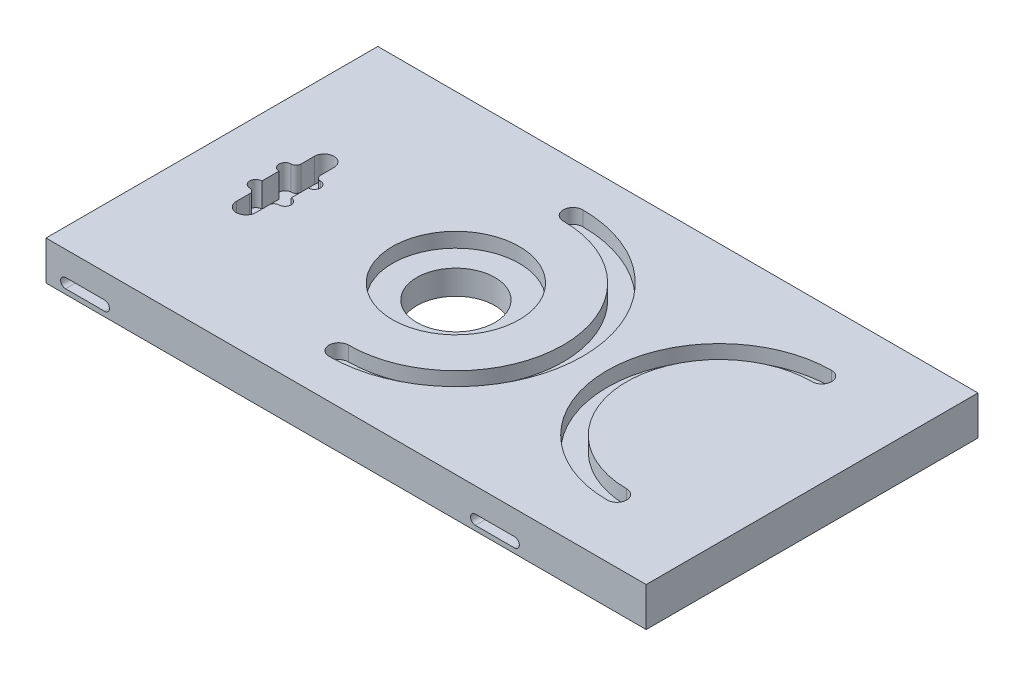
from build123d import *

# Parameters (mm, degrees)
SKETCH1_W              = 123
SKETCH1_H              = 68
BOSS_EXTRUDE1_DEPTH    = 8
CUT_EXTRUDE1_DEPTH     = 5
LPATTERN6_COUNT        = 2
LPATTERN6_PITCH        = 84
LPATTERN6_COPY_1_DEPTH = 5
SKETCH7_R              = 8
CUT_EXTRUDE2_DEPTH     = 10
SKETCH8_R              = 13
CUT_EXTRUDE3_DEPTH     = 3
CUT_EXTRUDE4_DEPTH     = 5
CUT_EXTRUDE5_DEPTH     = 3
CUT_EXTRUDE6_DEPTH     = 3
CUT_EXTRUDE7_DEPTH     = 5
FILLET2_R              = 1


with BuildPart() as part:
    # Sketch1 → Boss-Extrude1 (new body)
    with BuildSketch(Plane(origin=(0, 0, 0), x_dir=(1, 0, 0), z_dir=(0, 1, 0))):
        Rectangle(SKETCH1_W, SKETCH1_H)
    extrude(amount=BOSS_EXTRUDE1_DEPTH)

    # Sketch6 → Cut-Extrude1 (cut)
    with BuildSketch(Plane(origin=(0, 0, -34), x_dir=(-1, 0, 0), z_dir=(0, 0, -1))):
        with BuildLine():
            Line((49.5, 3), (57.5, 3))
            ThreePointArc((57.5, 3), (58.5, 2), (57.5, 1))
            Line((57.5, 1), (49.5, 1))
            ThreePointArc((49.5, 1), (48.5, 2), (49.5, 3))
        make_face()
    cut_extrude1 = extrude(amount=-CUT_EXTRUDE1_DEPTH, mode=Mode.SUBTRACT)

    # Mirror16: Cut-Extrude1 across plane
    add(cut_extrude1.mirror(Plane.XY), mode=Mode.SUBTRACT)

    # LPattern6: Cut-Extrude1 ×2
    with Locations(*[(i * LPATTERN6_PITCH, 0, 0) for i in range(1, LPATTERN6_COUNT)]):
        add(cut_extrude1, mode=Mode.SUBTRACT)

    # LPattern6 copy 1 sketch → LPattern6 copy 1 (cut)
    with BuildSketch(Plane(origin=(84, 0, 34), x_dir=(-1, 0, 0), z_dir=(0, 0, 1))):
        with BuildLine():
            Line((49.5, -3), (57.5, -3))
            ThreePointArc((57.5, -3), (58.5, -2), (57.5, -1))
            Line((57.5, -1), (49.5, -1))
            ThreePointArc((49.5, -1), (48.5, -2), (49.5, -3))
        make_face()
    extrude(amount=-LPATTERN6_COPY_1_DEPTH, mode=Mode.SUBTRACT)

    # Sketch7 → Cut-Extrude2 (cut)
    with BuildSketch(Plane(origin=(0, 8, 0), x_dir=(1, 0, 0), z_dir=(0, 1, 0))):
        with Locations(Location((-11.5, 0, 0), (0, 0, 270))):
            Circle(SKETCH7_R)
    extrude(amount=-CUT_EXTRUDE2_DEPTH, mode=Mode.SUBTRACT)

    # Sketch8 → Cut-Extrude3 (cut)
    with BuildSketch(Plane(origin=(0, 8, 0), x_dir=(1, 0, 0), z_dir=(0, 1, 0))):
        with Locations(Location((-11.5, 0, 0), (0, 0, 270))):
            Circle(SKETCH8_R)
    extrude(amount=-CUT_EXTRUDE3_DEPTH, mode=Mode.SUBTRACT)

    # Sketch9 → Cut-Extrude4 (cut)
    with BuildSketch(Plane(origin=(0, 8, 0), x_dir=(1, 0, 0), z_dir=(0, 1, 0))):
        with BuildLine():
            Line((-44.5, 8), (-44.5, -8))
            ThreePointArc((-44.5, -8), (-46.5, -10), (-48.5, -8))
            Line((-48.5, -8), (-48.5, 8))
            ThreePointArc((-48.5, 8), (-46.5, 10), (-44.5, 8))
        make_face()
    extrude(amount=-CUT_EXTRUDE4_DEPTH, mode=Mode.SUBTRACT)

    # Sketch10 → Cut-Extrude5 (cut)
    with BuildSketch(Plane(origin=(0, 8, 0), x_dir=(1, 0, 0), z_dir=(0, 1, 0))):
        with BuildLine():
            ThreePointArc((42.5, 23), (19.5, 0), (42.5, -23))
            ThreePointArc((42.5, -23), (44.5, -21), (42.5, -19))
            ThreePointArc((42.5, -19), (23.5, 0), (42.5, 19))
            ThreePointArc((42.5, 19), (44.5, 21), (42.5, 23))
        make_face()
    extrude(amount=-CUT_EXTRUDE5_DEPTH, mode=Mode.SUBTRACT)

    # Sketch11 → Cut-Extrude6 (cut)
    with BuildSketch(Plane(origin=(0, 8, 0), x_dir=(1, 0, 0), z_dir=(0, 1, 0))):
        with BuildLine():
            ThreePointArc((-11.5, -26), (14.5, 0), (-11.5, 26))
            ThreePointArc((-11.5, 26), (-13.5, 24), (-11.5, 22))
            ThreePointArc((-11.5, 22), (10.5, 0), (-11.5, -22))
            ThreePointArc((-11.5, -22), (-13.5, -24), (-11.5, -26))
        make_face()
    extrude(amount=-CUT_EXTRUDE6_DEPTH, mode=Mode.SUBTRACT)

    # Sketch12 → Cut-Extrude7 (cut)
    with BuildSketch(Plane(origin=(0, 8, 0), x_dir=(1, 0, 0), z_dir=(0, 1, 0))):
        with BuildLine():
            Line((-48.25, 3), (-44.75, 3))
            ThreePointArc((-44.75, 3), (-42.616116524, 3.883883476), (-43.5, 1.75))
            Line((-43.5, 1.75), (-43.5, -1.75))
            ThreePointArc((-43.5, -1.75), (-42.616116524, -3.883883476), (-44.75, -3))
            Line((-44.75, -3), (-48.25, -3))
            ThreePointArc((-48.25, -3), (-50.383883476, -3.883883476), (-49.5, -1.75))
            Line((-49.5, -1.75), (-49.5, 1.75))
            ThreePointArc((-49.5, 1.75), (-50.383883476, 3.883883476), (-48.25, 3))
        make_face()
    extrude(amount=-CUT_EXTRUDE7_DEPTH, mode=Mode.SUBTRACT)

    # Fillet2
    fillet2_edges = [part.edges().sort_by_distance(p)[0] for p in [
        (-48.5, 5.5, -3.75),
        (-44.5, 5.5, -3.75),
        (-44.5, 5.5, 3.75),
        (-48.5, 5.5, 3.75),
    ]]
    fillet(fillet2_edges, radius=FILLET2_R)


solid = part.part
